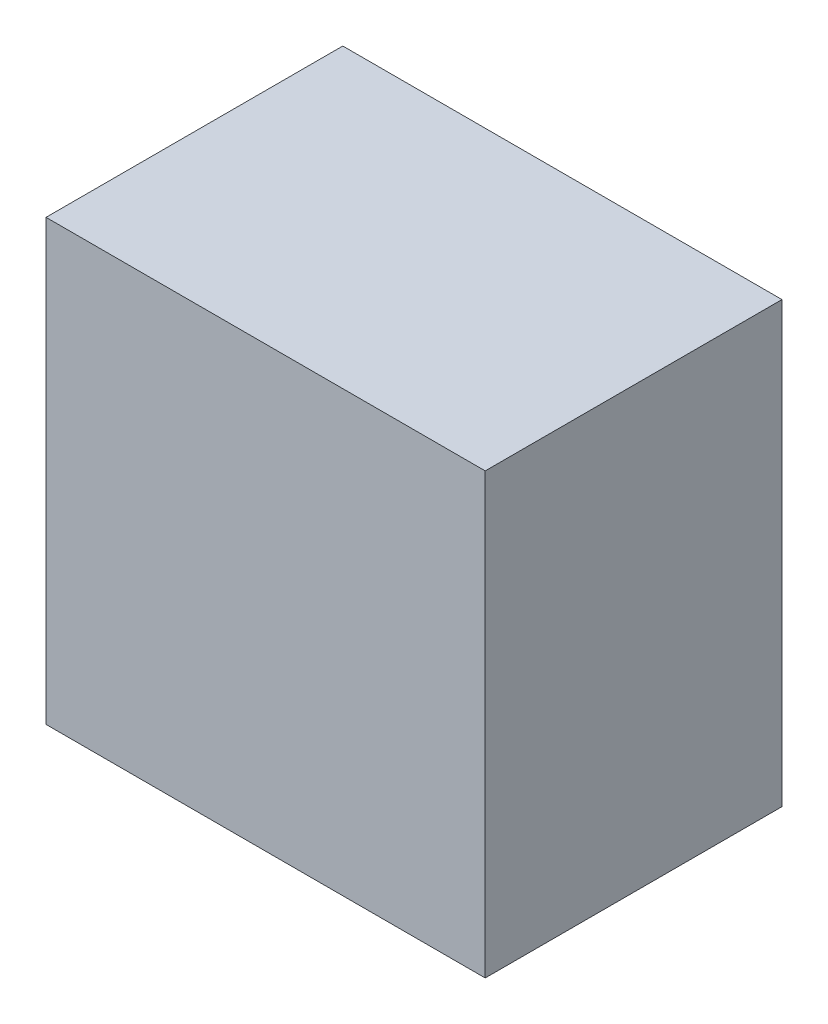
from build123d import *

# Parameters (mm, degrees)
REFERENCE_BACK_BOUNDS_37X37_W                  = 37
REFERENCE_BACK_BOUNDS_37X37_H                  = 37
REAR25_CLEARANCE_ENVELOPE_NOT_REAL_SHAPE_DEPTH = 25


with BuildPart() as part:
    # Reference_back_bounds_37x37 → Rear25_CLEARANCE_ENVELOPE_NOT_REAL_SHAPE (new body)
    with BuildSketch(Plane.XY):
        Rectangle(REFERENCE_BACK_BOUNDS_37X37_W, REFERENCE_BACK_BOUNDS_37X37_H)
    extrude(amount=REAR25_CLEARANCE_ENVELOPE_NOT_REAL_SHAPE_DEPTH)


solid = part.part
